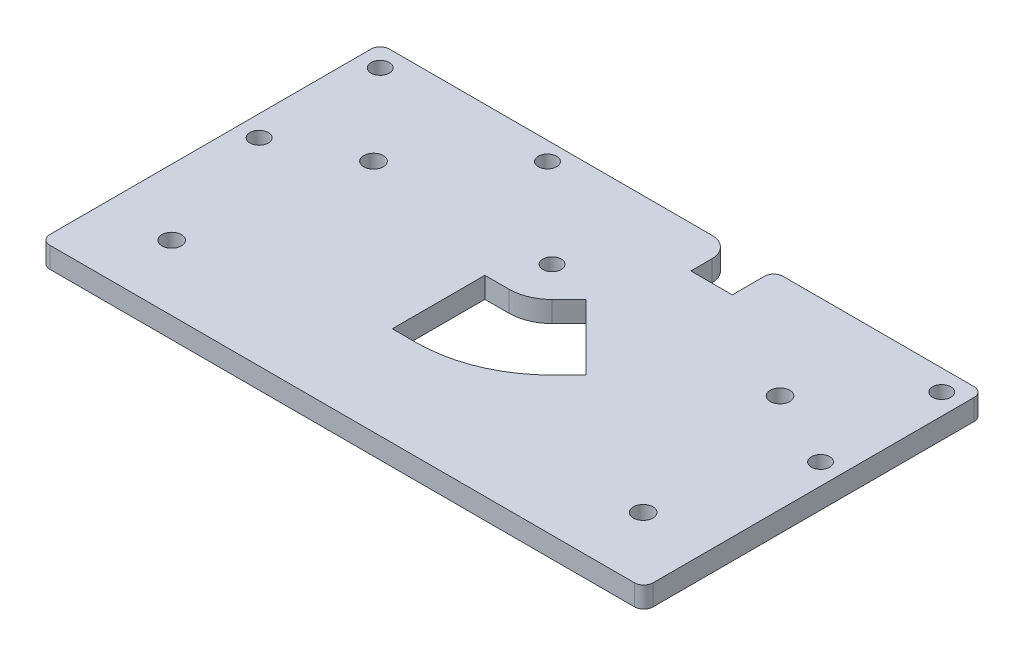
from build123d import *

# Parameters (mm, degrees)
SKETCH1_R           = 1.975
SKETCH1_R_2         = 2.1082
BOSS_EXTRUDE1_DEPTH = 4.5


with BuildPart() as part:
    # Sketch1 → Boss-Extrude1 (new body)
    with BuildSketch(Plane(origin=(0, 0, 0), x_dir=(1, 0, 0), z_dir=(0, 1, 0))):
        with BuildLine():
            Line((63, 20.3), (21.8, 20.3))
            ThreePointArc((21.8, 20.3), (20.385786438, 19.714213562), (19.8, 18.3))
            Line((19.8, 18.3), (19.8, 11.37))
            Line((19.8, 11.37), (10.87, 11.37))
            Line((10.87, 11.37), (10.87, 15.95))
            ThreePointArc((10.87, 15.95), (9.595914498, 19.025914498), (6.52, 20.3))
            Line((6.52, 20.3), (-63, 20.3))
            ThreePointArc((-63, 20.3), (-64.414213562, 19.714213562), (-65, 18.3))
            Line((-65, 18.3), (-65, -50.9))
            ThreePointArc((-65, -50.9), (-64.414213562, -52.314213562), (-63, -52.9))
            Line((-63, -52.9), (63, -52.9))
            ThreePointArc((63, -52.9), (64.414213562, -52.314213562), (65, -50.9))
            Line((65, -50.9), (65, 18.3))
            ThreePointArc((65, 18.3), (64.414213562, 19.714213562), (63, 20.3))
        make_face()
        with Locations(Location((-60.5, 15.8, 0), (0, 0, 270))):
            Circle(SKETCH1_R, mode=Mode.SUBTRACT)
        with Locations(Location((60.5, 15.8, 0), (0, 0, 90))):
            Circle(SKETCH1_R, mode=Mode.SUBTRACT)
        with Locations(Location((60.5, -10.3, 0), (0, 0, 270))):
            Circle(SKETCH1_R, mode=Mode.SUBTRACT)
        with Locations(Location((-60.5, -10.3, 0), (0, 0, 90))):
            Circle(SKETCH1_R, mode=Mode.SUBTRACT)
        with Locations(Location((-25.004260819, 16.35, 0), (0, 0, 270))):
            Circle(SKETCH1_R, mode=Mode.SUBTRACT)
        with Locations(Location((-5.328324842, -2.339651524, 0), (0, 0, 270))):
            Circle(SKETCH1_R, mode=Mode.SUBTRACT)
        with Locations(Location((-50.8, -38.838722529, 0), (0, 0, 270))):
            Circle(SKETCH1_R_2, mode=Mode.SUBTRACT)
        with Locations(Location((50.8, -38.838722529, 0), (0, 0, 90))):
            Circle(SKETCH1_R_2, mode=Mode.SUBTRACT)
        with Locations(Location((-43.8023, -2.339651524, 0), (0, 0, 270))):
            Circle(SKETCH1_R_2, mode=Mode.SUBTRACT)
        with Locations(Location((43.8023, -2.339651524, 0), (0, 0, 90))):
            Circle(SKETCH1_R_2, mode=Mode.SUBTRACT)
        with BuildLine():
            Line((-5.328324842, -31.589651524), (-10.508324842, -31.589651524))
            Line((-10.508324842, -31.589651524), (-10.5114167, -11.629651524))
            Line((-10.5114167, -11.629651524), (-5.328324842, -11.629651524))
            ThreePointArc((-5.328324842, -11.629651524), (-1.773195755, -10.922492381), (1.240697155, -8.908673522))
            Line((1.240697155, -8.908673522), (4.903510282, -5.245860395))
            Line((4.903510282, -5.245860395), (19.017361634, -19.359711748))
            Line((19.017361634, -19.359711748), (15.354548508, -23.022524874))
            ThreePointArc((15.354548508, -23.022524874), (5.865165555, -29.36312785), (-5.328324842, -31.589651524))
        make_face(mode=Mode.SUBTRACT)
    extrude(amount=BOSS_EXTRUDE1_DEPTH)


solid = part.part
